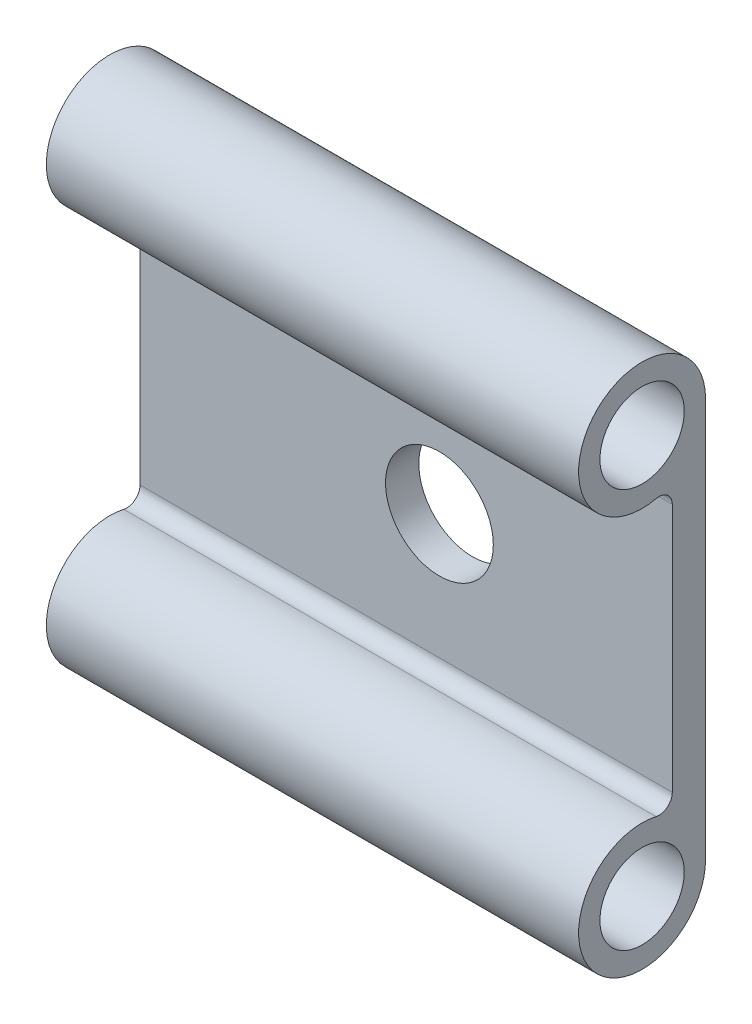
from build123d import *

# Parameters (mm, degrees)
SKETCH1_R           = 4.0259
BOSS_EXTRUDE1_DEPTH = 50.8
SKETCH7_R           = 5.1435
CUT_EXTRUDE3_DEPTH  = 68.900648282


with BuildPart() as part:
    # Sketch1 → Boss-Extrude1 (new body)
    with BuildSketch(Plane(origin=(0, 0, 0), x_dir=(0, 0, -1), z_dir=(1, 0, 0))):
        with BuildLine():
            Line((2.8829, 30.951806382), (2.8829, 7.148193618))
            ThreePointArc((2.8829, 7.148193618), (2.405961877, 6.156249638), (1.333367938, 5.909338572))
            ThreePointArc((1.333367938, 5.909338572), (-4.731572785, -3.782905152), (6.0579, 0))
            Line((6.0579, 0), (6.0579, 38.1))
            ThreePointArc((6.0579, 38.1), (-4.731572785, 41.882905152), (1.333367938, 32.190661428))
            ThreePointArc((1.333367938, 32.190661428), (2.405961877, 31.943750362), (2.8829, 30.951806382))
        make_face()
        Circle(SKETCH1_R, mode=Mode.SUBTRACT)
        with Locations((0, 38.1)):
            Circle(SKETCH1_R, mode=Mode.SUBTRACT)
    extrude(amount=BOSS_EXTRUDE1_DEPTH)

    # Sketch7 → Cut-Extrude3 (cut, through all)
    with BuildSketch(Plane.XY.offset(-2.8829)):
        with Locations((28.575, 19.05)):
            Circle(SKETCH7_R)
    extrude(amount=-CUT_EXTRUDE3_DEPTH, mode=Mode.SUBTRACT)


solid = part.part
